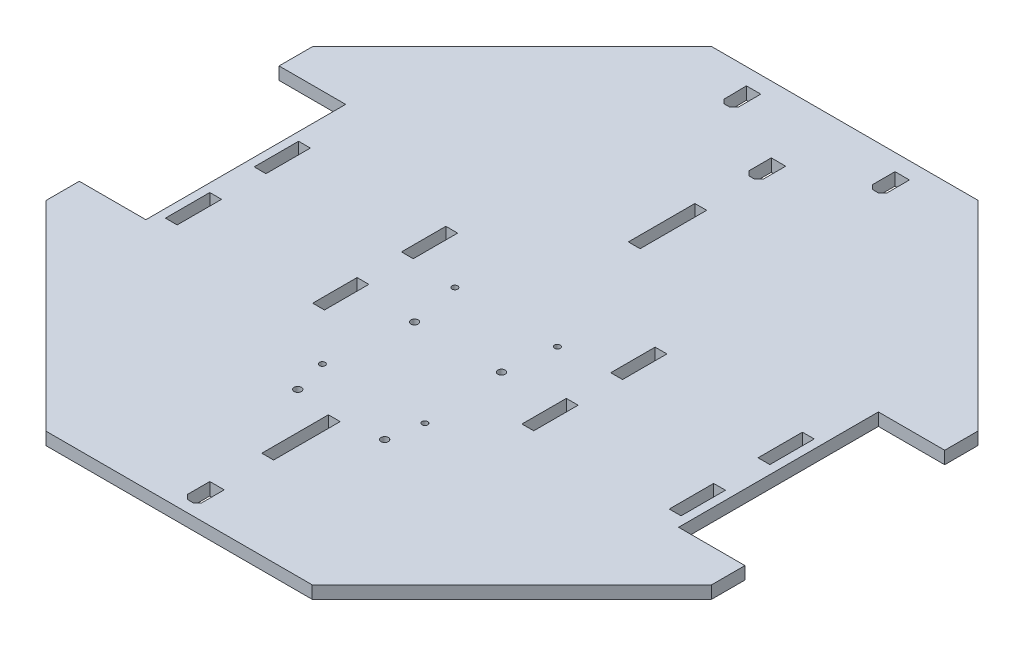
from build123d import *

# Parameters (mm, degrees)
SKETCH1_W            = 254
SKETCH1_H            = 254
BOSS_EXTRUDE1_DEPTH  = 4.800000052
CUT_EXTRUDE2_DEPTH   = 360.242313767
CUT_EXTRUDE3_DEPTH   = 4.826
CUT_EXTRUDE5_DEPTH   = 4.826
CUT_EXTRUDE6_DEPTH   = 4.826
SKETCH16_OUTSIDE_W   = 327.848
SKETCH16_OUTSIDE_H   = 327.848
CUT_EXTRUDE8_DEPTH   = 360.242313767
SKETCH17_OUTSIDE_W   = 327.848
SKETCH17_OUTSIDE_H   = 327.848
CUT_EXTRUDE17_DEPTH  = 360.242313767
SKETCH18_OUTSIDE_W   = 327.848
SKETCH18_OUTSIDE_H   = 327.848
CUT_EXTRUDE18_DEPTH  = 216.155906991
SKETCH19_OUTSIDE_W   = 327.734
SKETCH19_OUTSIDE_H   = 327.834
SKETCH19_OUTSIDE_W_2 = 4.500000144
SKETCH19_OUTSIDE_H_2 = 16.933333333
CUT_EXTRUDE19_DEPTH  = 364.309275828
SKETCH32_W           = 4.800000052
SKETCH32_H           = 76.2
CUT_EXTRUDE22_DEPTH  = 25.4
CUT_EXTRUDE23_DEPTH  = 216.155906991
SKETCH34_W           = 4.800000052
SKETCH34_H           = 76.2
CUT_EXTRUDE24_DEPTH  = 25.4
SKETCH36_W           = 4.500000144
SKETCH36_H           = 16.933333333
CUT_EXTRUDE26_DEPTH  = 364.309275828
SKETCH37_W           = 4.500000144
SKETCH37_H           = 25.4
CUT_EXTRUDE27_DEPTH  = 360.171616324
SKETCH48_W           = 4.500000144
SKETCH48_H           = 25.4
CUT_EXTRUDE34_DEPTH  = 360.171616324
SKETCH50_R           = 1.4
CUT_EXTRUDE35_DEPTH  = 506.24041807
SKETCH51_R           = 1.1
CUT_EXTRUDE36_DEPTH  = 1021.904407936


with BuildPart() as part:
    # Sketch1 → Boss-Extrude1 (new body)
    with BuildSketch(Plane(origin=(0, 0, 0), x_dir=(1, 0, 0), z_dir=(0, 1, 0))):
        with Locations((127, 127)):
            Rectangle(SKETCH1_W, SKETCH1_H)
    extrude(amount=BOSS_EXTRUDE1_DEPTH)

    # Sketch4 → Cut-Extrude2 (cut, through all)
    with BuildSketch(Plane(origin=(0, 4.800000052, 0), x_dir=(1, 0, 0), z_dir=(0, 1, 0))):
        Polygon((76.2, 254), (0, 177.8), (0, 254), align=None)
    extrude(amount=-CUT_EXTRUDE2_DEPTH, mode=Mode.SUBTRACT)

    # Sketch5 → Cut-Extrude3 (cut)
    with BuildSketch(Plane(origin=(0, 4.800000052, 0), x_dir=(1, 0, 0), z_dir=(0, 1, 0))):
        Polygon((177.8, 254), (254, 177.8), (254, 254), align=None)
    extrude(amount=-CUT_EXTRUDE3_DEPTH, mode=Mode.SUBTRACT)

    # Sketch9 → Cut-Extrude5 (cut)
    with BuildSketch(Plane(origin=(0, 4.800000052, 0), x_dir=(1, 0, 0), z_dir=(0, 1, 0))):
        Polygon((0, 76.2), (0, 0), (76.2, 0), align=None)
    extrude(amount=-CUT_EXTRUDE5_DEPTH, mode=Mode.SUBTRACT)

    # Sketch11 → Cut-Extrude6 (cut)
    with BuildSketch(Plane(origin=(0, 4.800000052, 0), x_dir=(1, 0, 0), z_dir=(0, 1, 0))):
        Polygon((254, 76.2), (254, 0), (177.8, 0), align=None)
    extrude(amount=-CUT_EXTRUDE6_DEPTH, mode=Mode.SUBTRACT)

    # Sketch16 outside → Cut-Extrude8 (cut, through all)
    # profile 1 of 2: a face of its own
    with BuildSketch(Plane.XZ):
        with Locations((127, -127)):
            Rectangle(SKETCH16_OUTSIDE_W, SKETCH16_OUTSIDE_H)
        Polygon((254, -76.2), (177.8, 0), (76.2, 0), (0, -76.2), (0, -177.8), (76.2, -254), (177.8, -254), (254, -177.8), align=None, mode=Mode.SUBTRACT)
    # profile 2 of 2: a face of its own
    with BuildSketch(Plane.XZ):
        Polygon((154.05, -237.45), (152.4, -239.09956871), (152.4, -247.65), (157.899988492, -247.65), (157.899988492, -247.233680101), (157.899988492, -246.283680101), (157.899988492, -243.349999982), (157.899988492, -243.025), (157.899988492, -242.075), (157.899988492, -241.750000018), (157.899988492, -240.049999963), (157.899991793, -239.09957201), (156.249995092, -237.45), align=None)
    extrude(amount=-CUT_EXTRUDE8_DEPTH, mode=Mode.SUBTRACT)

    # Sketch17 outside → Cut-Extrude17 (cut, through all)
    # profile 1 of 2: a face of its own
    with BuildSketch(Plane.XZ):
        with Locations((127, -127)):
            Rectangle(SKETCH17_OUTSIDE_W, SKETCH17_OUTSIDE_H)
        Polygon((254, -76.2), (177.8, 0), (76.2, 0), (0, -76.2), (0, -177.8), (76.2, -254), (177.8, -254), (254, -177.8), align=None, mode=Mode.SUBTRACT)
    # profile 2 of 2: a face of its own
    with BuildSketch(Plane.XZ):
        Polygon((125.900002454, -218.4), (128.099997546, -218.4), (129.749994246, -220.04956871), (129.749994246, -220.999999963), (129.749994246, -222.700000018), (129.749994246, -223.025), (129.749994246, -223.975), (129.749994246, -224.299999982), (129.749994246, -227.233680101), (129.749994246, -228.183680101), (129.749994246, -228.6), (124.250005754, -228.6), (124.250005754, -228.183680101), (124.250005754, -228.15), (124.250005754, -227.233680101), (124.250005754, -224.299999982), (124.250005754, -223.975), (124.250005754, -223.025), (124.250005754, -222.700000018), (124.250005754, -220.999999963), (124.250005754, -220.04956871), align=None)
    extrude(amount=-CUT_EXTRUDE17_DEPTH, mode=Mode.SUBTRACT)

    # Sketch18 outside → Cut-Extrude18 (cut, through all)
    # profile 1 of 2: a face of its own
    with BuildSketch(Plane(origin=(166.661666982, 4.800000052, -135.988650526), x_dir=(1, 0, 0), z_dir=(0, 1, 0))):
        with Locations((-39.662, -8.989)):
            Rectangle(SKETCH18_OUTSIDE_W, SKETCH18_OUTSIDE_H)
        Polygon((-90.561667036, -135.988650526), (11.038332964, -135.988650526), (87.238332964, -59.788650526), (87.238332964, 41.811349474), (11.038332964, 118.011349474), (-90.561667036, 118.011349474), (-166.761667036, 41.811349474), (-166.761667036, -59.788650526), align=None, mode=Mode.SUBTRACT)
    # profile 2 of 2: a face of its own
    with BuildSketch(Plane(origin=(166.661666982, 4.800000052, -135.988650526), x_dir=(1, 0, 0), z_dir=(0, 1, 0))):
        Polygon((-65.461678544, 103.110918185), (-65.461678544, 111.661349474), (-70.961667036, 111.661349474), (-70.812431754, 103.061695826), (-69.211666982, 101.461349474), (-67.01167189, 101.461349474), align=None)
    extrude(amount=-CUT_EXTRUDE18_DEPTH, mode=Mode.SUBTRACT)

    # Sketch19 outside → Cut-Extrude19 (cut, through all)
    # profile 1 of 3: a face of its own
    with BuildSketch(Plane(origin=(277.632305151, 0, -234.288055689), x_dir=(1, 0, 0), z_dir=(0, -1, 0))):
        with Locations((-150.682, 107.288)):
            Rectangle(SKETCH19_OUTSIDE_W, SKETCH19_OUTSIDE_H)
        Polygon((-23.632305151, 158.088055689), (-99.832305151, 234.288055689), (-201.432305151, 234.288055689), (-277.632305151, 158.088055689), (-277.632305151, 56.488055689), (-201.432305151, -19.711944311), (-99.832305151, -19.711944311), (-23.632305151, 56.488055689), align=None, mode=Mode.SUBTRACT)
    # profile 2 of 3: a face of its own
    with BuildSketch(Plane(origin=(277.632305151, 0, -234.288055689), x_dir=(1, 0, 0), z_dir=(0, -1, 0))):
        with Locations((-54.584305223, 132.68805569)):
            Rectangle(SKETCH19_OUTSIDE_W_2, SKETCH19_OUTSIDE_H_2)
    # profile 3 of 3: a face of its own
    with BuildSketch(Plane(origin=(277.632305151, 0, -234.288055689), x_dir=(1, 0, 0), z_dir=(0, -1, 0))):
        with Locations((-54.584305223, 98.821389023)):
            Rectangle(SKETCH19_OUTSIDE_W_2, SKETCH19_OUTSIDE_H_2)
    cut_extrude19 = extrude(amount=-CUT_EXTRUDE19_DEPTH, mode=Mode.SUBTRACT)

    # Mirror2: Cut-Extrude19 across plane
    add(cut_extrude19.mirror(Plane(origin=(126.949999973, 0, 0), x_dir=(0, 0, 1), z_dir=(1, 0, 0))), mode=Mode.SUBTRACT)

    # Sketch32 → Cut-Extrude22 (cut)
    with BuildSketch(Plane(origin=(254, 6.738807757, -234.288055689), x_dir=(0, 1, 0), z_dir=(1, 0, 0))):
        with Locations((-4.338807731, 107.288055689)):
            Rectangle(SKETCH32_W, SKETCH32_H)
    extrude(amount=-CUT_EXTRUDE22_DEPTH, mode=Mode.SUBTRACT)

    # Sketch33 → Cut-Extrude23 (cut, through all)
    with BuildSketch(Plane(origin=(166.661666982, 0, -135.988650526), x_dir=(1, 0, 0), z_dir=(0, -1, 0))):
        Polygon((-42.582666982, 122.75320968), (-42.582666982, 125.686889799), (-42.582666982, 126.011889781), (-42.582666982, 126.961889781), (-42.582666982, 127.286889763), (-42.582666982, 128.986889819), (-42.582666982, 129.937321071), (-40.932670282, 131.586889781), (-38.73267519, 131.586889781), (-37.08267849, 129.937321071), (-37.08267849, 122.75320968), (-37.08267849, 121.80320968), (-37.08267849, 121.386889781), (-42.582666982, 121.386889781), (-42.582666982, 121.836889781), align=None)
    extrude(amount=-CUT_EXTRUDE23_DEPTH, mode=Mode.SUBTRACT)

    # Sketch34 → Cut-Extrude24 (cut)
    with BuildSketch(Plane(origin=(0, 6.738807757, -234.288055689), x_dir=(0, -1, 0), z_dir=(-1, 0, 0))):
        with Locations((4.338807731, 107.288055689)):
            Rectangle(SKETCH34_W, SKETCH34_H)
    extrude(amount=-CUT_EXTRUDE24_DEPTH, mode=Mode.SUBTRACT)

    # Sketch36 → Cut-Extrude26 (cut, through all)
    with BuildSketch(Plane(origin=(277.632305151, 0, -234.288055689), x_dir=(1, 0, 0), z_dir=(0, -1, 0))):
        with Locations((-110.770919354, 132.68805569)):
            Rectangle(SKETCH36_W, SKETCH36_H)
        with Locations((-110.770883223, 98.821389023)):
            Rectangle(SKETCH36_W, SKETCH36_H)
    cut_extrude26 = extrude(amount=-CUT_EXTRUDE26_DEPTH, mode=Mode.SUBTRACT)

    # Mirror3: Cut-Extrude26 across plane
    add(cut_extrude26.mirror(Plane(origin=(126.949999973, 0, 0), x_dir=(0, 0, 1), z_dir=(1, 0, 0))), mode=Mode.SUBTRACT)

    # Sketch37 → Cut-Extrude27 (cut, through all)
    with BuildSketch(Plane(origin=(0, 4.800000052, 0), x_dir=(1, 0, 0), z_dir=(0, 1, 0))):
        with Locations((127, 186.266666667)):
            Rectangle(SKETCH37_W, SKETCH37_H)
    extrude(amount=-CUT_EXTRUDE27_DEPTH, mode=Mode.SUBTRACT)

    # Sketch48 → Cut-Extrude34 (cut, through all)
    with BuildSketch(Plane(origin=(0, 0, 0), x_dir=(-1, 0, 0), z_dir=(0, -1, 0))):
        with Locations((-126.899999946, 46.566666667)):
            Rectangle(SKETCH48_W, SKETCH48_H)
    extrude(amount=-CUT_EXTRUDE34_DEPTH, mode=Mode.SUBTRACT)

    # Sketch50 → Cut-Extrude35 (cut, through all)
    with BuildSketch(Plane(origin=(0, 4.800000052, -436.783275868), x_dir=(1, 0, 0), z_dir=(0, 1, 0))):
        with Locations(Location((143.575, -330.426609202, 0), (0, 0, 270))):
            Circle(SKETCH50_R)
        with Locations(Location((110.425, -330.426609202, 0), (0, 0, 270))):
            Circle(SKETCH50_R)
        with Locations(Location((143.575, -374.976609202, 0), (0, 0, 270))):
            Circle(SKETCH50_R)
        with Locations(Location((110.425, -374.976609202, 0), (0, 0, 270))):
            Circle(SKETCH50_R)
    extrude(amount=-CUT_EXTRUDE35_DEPTH, mode=Mode.SUBTRACT)

    # Sketch51 → Cut-Extrude36 (cut, through all)
    with BuildSketch(Plane(origin=(0, 4.800000052, -988.816241862), x_dir=(1, 0, 0), z_dir=(0, 1, 0))):
        with Locations(Location((145.841662515, -863.378312681, 0), (0, 0, 270))):
            Circle(SKETCH51_R)
        with Locations(Location((106.721662515, -863.378312681, 0), (0, 0, 270))):
            Circle(SKETCH51_R)
        with Locations(Location((145.841662515, -913.928312681, 0), (0, 0, 270))):
            Circle(SKETCH51_R)
        with Locations(Location((106.721662515, -913.928312681, 0), (0, 0, 270))):
            Circle(SKETCH51_R)
    extrude(amount=-CUT_EXTRUDE36_DEPTH, mode=Mode.SUBTRACT)


solid = part.part
